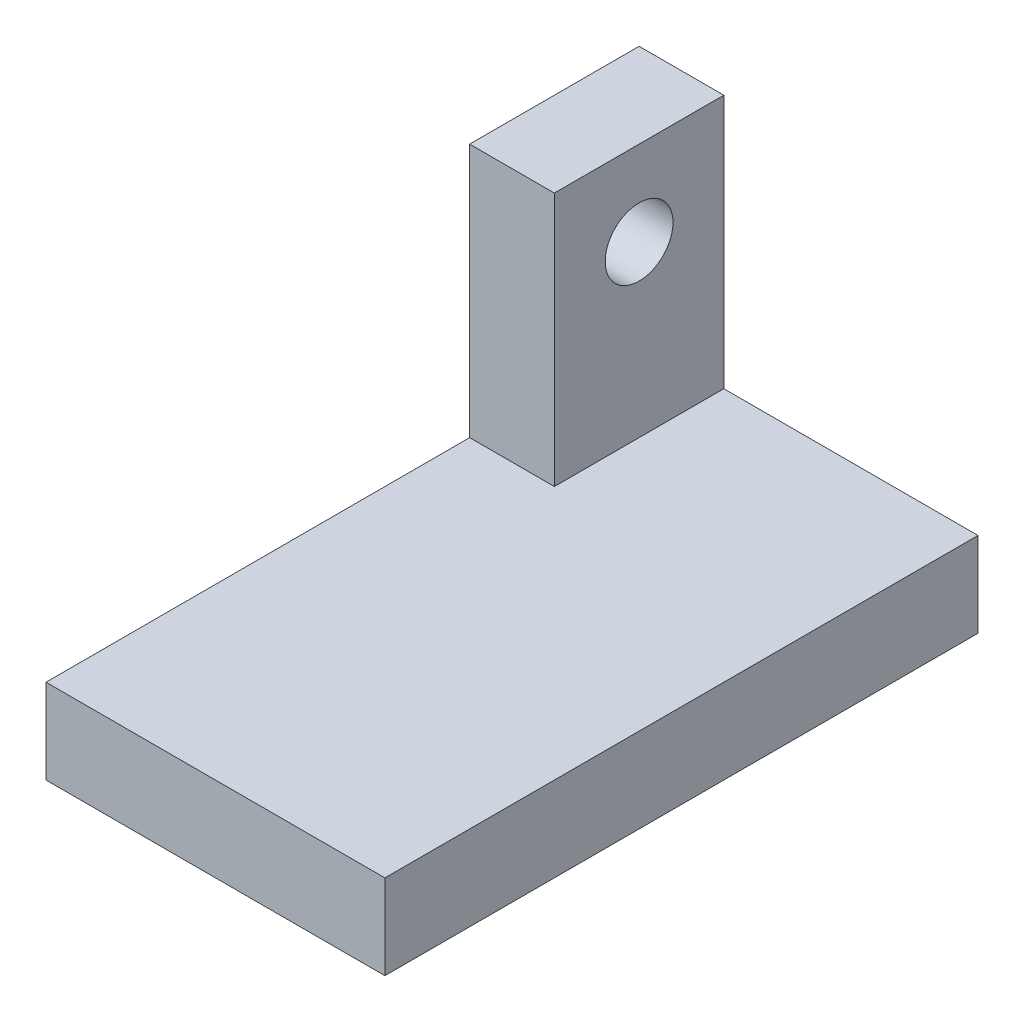
from build123d import *

# Parameters (mm, degrees)
SKETCH1_W           = 35
SKETCH1_H           = 5
BOSS_EXTRUDE1_DEPTH = 20
SKETCH2_W           = 5
SKETCH2_H           = 10
BOSS_EXTRUDE2_DEPTH = 15
SKETCH3_W           = 5
SKETCH3_H           = 10
BOSS_EXTRUDE3_DEPTH = 15
SKETCH4_R           = 2
CUT_EXTRUDE1_DEPTH  = 15


with BuildPart() as part:
    # Sketch1 → Boss-Extrude1 (new body)
    with BuildSketch(Plane(origin=(0, 0, 0), x_dir=(0, 0, -1), z_dir=(1, 0, 0))):
        with Locations((17.5, 2.5)):
            Rectangle(SKETCH1_W, SKETCH1_H)
    extrude(amount=BOSS_EXTRUDE1_DEPTH)

    # Sketch2 → Boss-Extrude2 (add)
    with BuildSketch(Plane(origin=(0, 5, 0), x_dir=(1, 0, 0), z_dir=(0, 1, 0))):
        with Locations((2.5, 30)):
            Rectangle(SKETCH2_W, SKETCH2_H)
    extrude(amount=BOSS_EXTRUDE2_DEPTH)

    # Sketch3 → Boss-Extrude3 (add)
    with BuildSketch(Plane.XZ):
        with Locations((2.5, -30)):
            Rectangle(SKETCH3_W, SKETCH3_H)
    extrude(amount=BOSS_EXTRUDE3_DEPTH)

    # Sketch4 → Cut-Extrude1 (cut)
    with BuildSketch(Plane(origin=(5, 0, 0), x_dir=(0, 0, -1), z_dir=(1, 0, 0))):
        with Locations((30, 15)):
            Circle(SKETCH4_R)
        with Locations((30, -10)):
            Circle(SKETCH4_R)
    extrude(amount=-CUT_EXTRUDE1_DEPTH, mode=Mode.SUBTRACT)


solid = part.part
